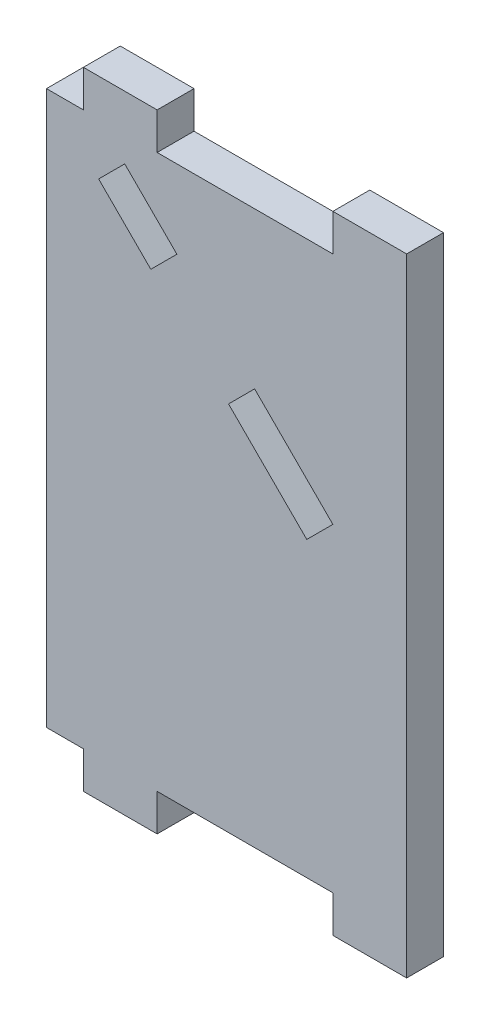
from build123d import *

# Parameters (mm, degrees)
BOSS_EXTRU_1_DEPTH = 5


with BuildPart() as part:
    # Esquisse1 → Boss.-Extru.1 (new body)
    with BuildSketch(Plane.XY):
        Polygon((-41.749094475, 67.928932188), (-48.820162287, 75), (-48.820162287, 0), (-43.820162287, 0), (-43.820162287, -5), (-33.820162287, -5), (-33.820162287, 0), (-10, 0), (-10, -5), (0, -5), (0, 0), (0, 26.179837713), (-13.535533906, 39.715371619), (-24.142135624, 50.321973337), (-34.678026663, 60.857864376), align=None)
        Polygon((-43.820162287, 75), (-48.820162287, 75), (-41.749094475, 67.928932188), (-38.213560569, 71.464466094), (-31.142492757, 64.393398282), (-34.678026663, 60.857864376), (-24.142135624, 50.321973337), (-20.606601718, 53.857507243), (-10, 43.250905525), (-13.535533906, 39.715371619), (0, 26.179837713), (0, 75), (0, 80), (-10, 80), (-10, 75), (-33.820162287, 75), (-33.820162287, 80), (-43.820162287, 80), align=None)
    extrude(amount=BOSS_EXTRU_1_DEPTH)


solid = part.part
